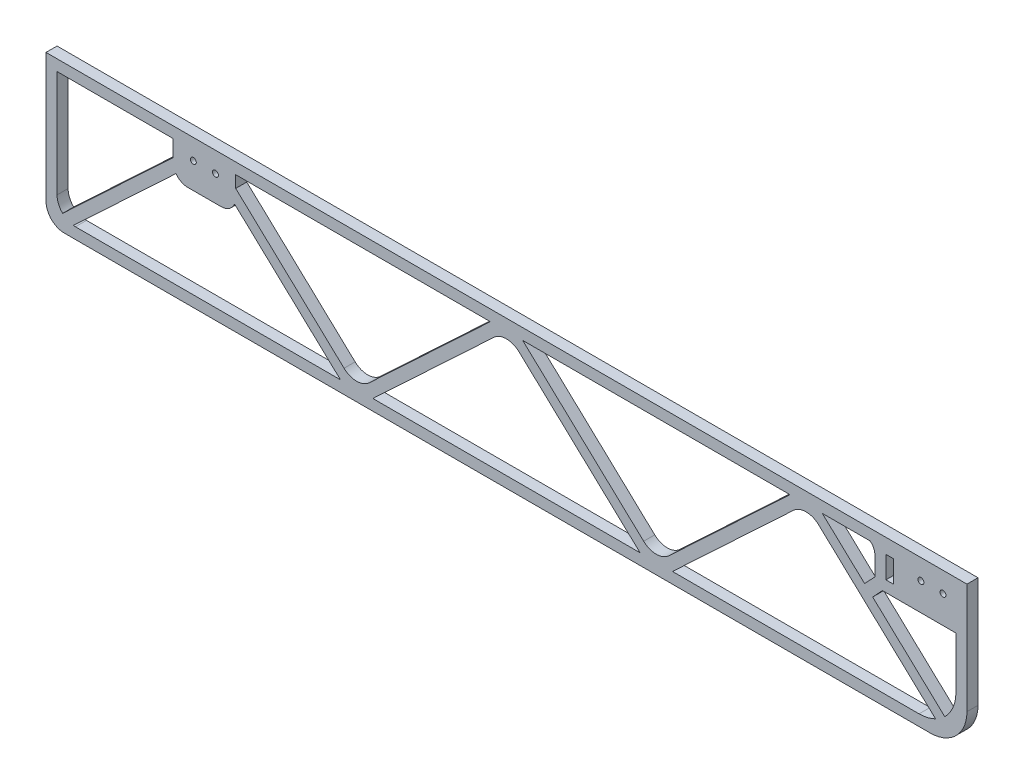
from build123d import *

# Parameters (mm, degrees)
SKETCH_1_R      = 0.8
SKETCH_1_W      = 2
SKETCH_1_H      = 6
EXTRUDE_1_DEPTH = 3


with BuildPart() as part:
    # 草图1 → 凸台-拉伸1 (new body)
    with BuildSketch(Plane.XY):
        with BuildLine():
            Line((125, 20), (-125, 20))
            Line((-125, 20), (-125, -15))
            ThreePointArc((-125, -15), (-123.535533906, -18.535533906), (-120, -20))
            Line((-120, -20), (115, -20))
            ThreePointArc((115, -20), (122.071067812, -17.071067812), (125, -10))
            Line((125, -10), (125, 20))
        make_face()
        with BuildLine():
            Line((-117.577166779, -16.966576135), (-89.725823654, 9.134823104))
            ThreePointArc((-89.725823654, 9.134823104), (-88.308216305, 7.932037866), (-86.5, 7.5))
            Line((-86.5, 7.5), (-77.5, 7.5))
            ThreePointArc((-77.5, 7.5), (-75.2858442, 8.168706844), (-73.811998968, 9.951242954))
            Line((-73.811998968, 9.951242954), (-45.053835151, -17))
            Line((-45.053835151, -17), (-117, -17))
            ThreePointArc((-117, -17), (-117.28906688, -16.99163704), (-117.577166779, -16.966576135))
        make_face(mode=Mode.SUBTRACT)
        with BuildLine():
            Line((36.279498182, -17), (-36.279498182, -17))
            Line((-36.279498182, -17), (-3.41906176, 13.795763292))
            ThreePointArc((-3.41906176, 13.795763292), (0, 15.147473736), (3.41906176, 13.795763292))
            Line((3.41906176, 13.795763292), (36.279498182, -17))
        make_face(mode=Mode.SUBTRACT)
        with BuildLine():
            Line((112, -17), (45.053835151, -17))
            Line((45.053835151, -17), (77.914271574, 13.795763292))
            ThreePointArc((77.914271574, 13.795763292), (81.333333333, 15.147473736), (84.752395093, 13.795763292))
            Line((84.752395093, 13.795763292), (116.481383158, -15.93964233))
            ThreePointArc((116.481383158, -15.93964233), (114.302561258, -16.731300615), (112, -17))
        make_face(mode=Mode.SUBTRACT)
        with BuildLine():
            Line((-90.5, 12.520805239), (-120.487704725, -15.582724626))
            ThreePointArc((-120.487704725, -15.582724626), (-121.606436998, -13.944412041), (-122, -12))
            Line((-122, -12), (-122, 17))
            Line((-122, 17), (-90.5, 17))
            Line((-90.5, 17), (-90.5, 12.520805239))
        make_face(mode=Mode.SUBTRACT)
        with BuildLine():
            Line((-73.5, 17), (-4.387168485, 17))
            Line((-4.387168485, 17), (-37.247604907, -13.795763292))
            ThreePointArc((-37.247604907, -13.795763292), (-40.666666667, -15.147473736), (-44.085728426, -13.795763292))
            Line((-44.085728426, -13.795763292), (-73.5, 13.770363133))
            Line((-73.5, 13.770363133), (-73.5, 17))
        make_face(mode=Mode.SUBTRACT)
        with Locations((-85, 14.5)):
            Circle(SKETCH_1_R, mode=Mode.SUBTRACT)
        with Locations((-79, 14.5)):
            Circle(SKETCH_1_R, mode=Mode.SUBTRACT)
        with BuildLine():
            Line((4.387168485, 17), (76.946164849, 17))
            Line((76.946164849, 17), (44.085728426, -13.795763292))
            ThreePointArc((44.085728426, -13.795763292), (40.666666667, -15.147473736), (37.247604907, -13.795763292))
            Line((37.247604907, -13.795763292), (4.387168485, 17))
        make_face(mode=Mode.SUBTRACT)
        with BuildLine():
            ThreePointArc((122, -7), (121.212873995, -10.888824083), (118.975409451, -14.165449253))
            Line((118.975409451, -14.165449253), (99.406893969, 4.173545488))
            Line((99.406893969, 4.173545488), (102.055757879, 7))
            Line((102.055757879, 7), (122, 7))
            Line((122, 7), (122, -7))
        make_face(mode=Mode.SUBTRACT)
        with BuildLine():
            Line((100, 9.193584242), (97.217920236, 6.224982544))
            Line((97.217920236, 6.224982544), (85.720501818, 17))
            Line((85.720501818, 17), (98.687816207, 17))
            ThreePointArc((98.687816207, 17), (99.653283041, 15.859737408), (100, 14.406426589))
            Line((100, 14.406426589), (100, 9.193584242))
        make_face(mode=Mode.SUBTRACT)
        with Locations((104, 13)):
            Rectangle(SKETCH_1_W, SKETCH_1_H, mode=Mode.SUBTRACT)
        with Locations((118.5, 14.5)):
            Circle(SKETCH_1_R, mode=Mode.SUBTRACT)
        with Locations((112.5, 14.5)):
            Circle(SKETCH_1_R, mode=Mode.SUBTRACT)
    extrude(amount=EXTRUDE_1_DEPTH)


solid = part.part
